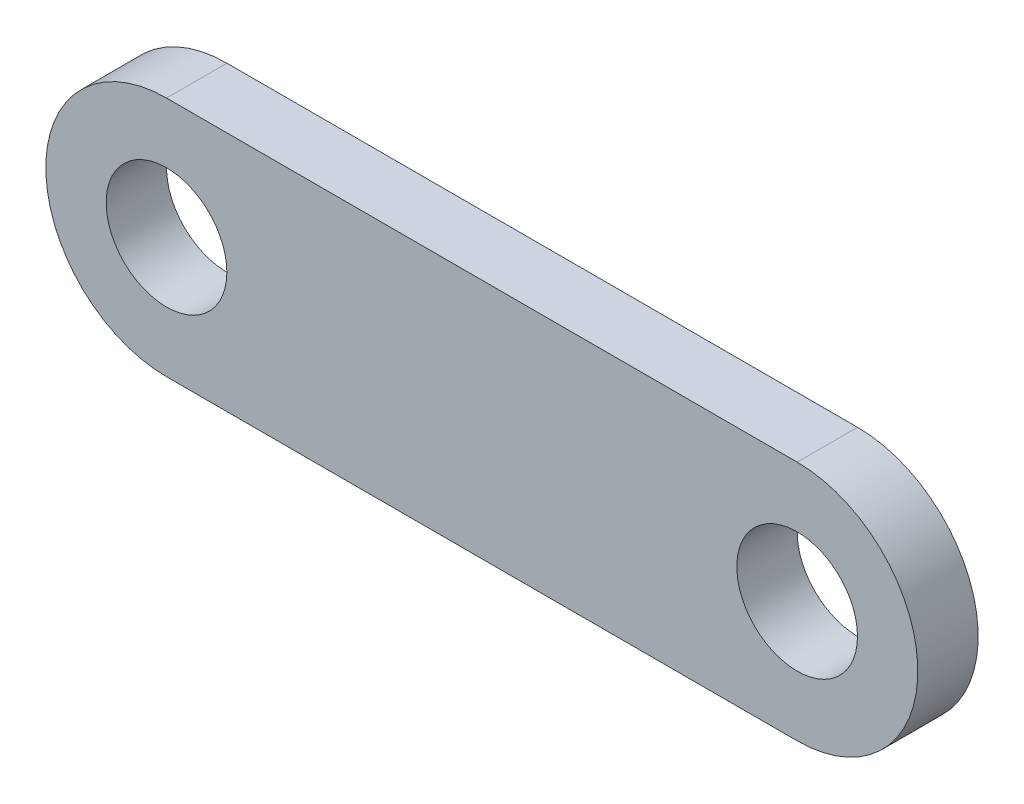
from build123d import *

# Parameters (mm, degrees)
ESBO_O1_R                = 1
RESSALTO_EXTRUS_O1_DEPTH = 1


with BuildPart() as part:
    # Esboço1 → Ressalto-extrusão1 (new body)
    with BuildSketch(Plane.XY):
        with BuildLine():
            Line((-5.225, 2), (5.225, 2))
            ThreePointArc((5.225, 2), (7.225, 0), (5.225, -2))
            Line((5.225, -2), (-5.225, -2))
            ThreePointArc((-5.225, -2), (-7.225, 0), (-5.225, 2))
        make_face()
        with Locations((-5.225, 0)):
            Circle(ESBO_O1_R, mode=Mode.SUBTRACT)
        with Locations((5.225, 0)):
            Circle(ESBO_O1_R, mode=Mode.SUBTRACT)
    extrude(amount=RESSALTO_EXTRUS_O1_DEPTH)


solid = part.part
